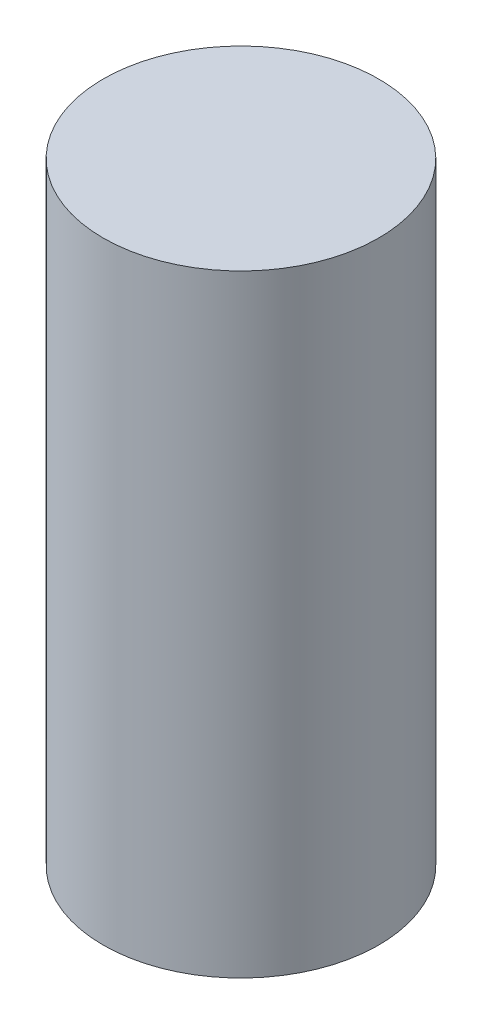
from build123d import *

# Parameters (mm, degrees)
SKETCH1_R           = 2.475
BOSS_EXTRUDE1_DEPTH = 11


with BuildPart() as part:
    # Sketch1 → Boss-Extrude1 (new body)
    with BuildSketch(Plane(origin=(0, 0, 0), x_dir=(1, 0, 0), z_dir=(0, 1, 0))):
        with Locations(Location((0, 0, 0), (0, 0, 270))):
            Circle(SKETCH1_R)
    extrude(amount=BOSS_EXTRUDE1_DEPTH)


solid = part.part
